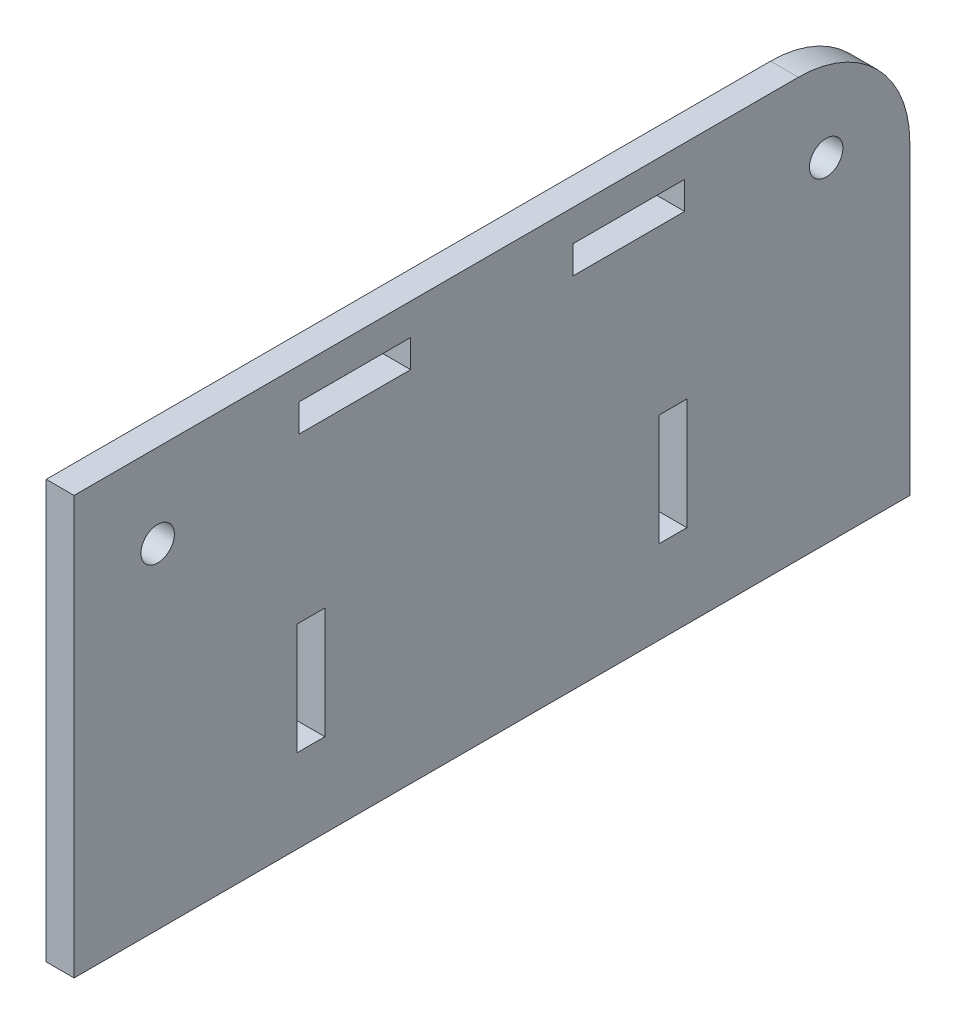
from build123d import *

# Parameters (mm, degrees)
SKETCH1_R           = 3.000854516
SKETCH1_W           = 5.001424193
SKETCH1_H           = 20.005696775
SKETCH1_W_2         = 20.005696776
SKETCH1_H_2         = 5.001424194
SKETCH1_W_3         = 20.005696775
SKETCH1_W_4         = 5.001424194
BOSS_EXTRUDE1_DEPTH = 5


with BuildPart() as part:
    # Sketch1 → Boss-Extrude1 (new body)
    with BuildSketch(Plane(origin=(0, 0, 0), x_dir=(0, 0, -1), z_dir=(1, 0, 0))):
        with BuildLine():
            Line((-105.391894776, -37.510681454), (44.616650387, -37.510681454))
            Line((44.616650387, -37.510681454), (44.616650387, 17.510681454))
            ThreePointArc((44.616650387, 17.510681454), (38.758786011, 31.652817078), (24.616650387, 37.510681454))
            Line((24.616650387, 37.510681454), (-105.391894776, 37.510681454))
            Line((-105.391894776, 37.510681454), (-105.391894776, -37.510681454))
        make_face()
        with Locations((29.612377806, 22.506408872)):
            Circle(SKETCH1_R, mode=Mode.SUBTRACT)
        with Locations(Location((-90.387622194, 22.506408872, 0), (0, 0, 180))):
            Circle(SKETCH1_R, mode=Mode.SUBTRACT)
        with Locations((2.10454474, -12.503560485)):
            Rectangle(SKETCH1_W, SKETCH1_H, mode=Mode.SUBTRACT)
        with Locations((-5.791359719, 29.352456285)):
            Rectangle(SKETCH1_W_2, SKETCH1_H_2, mode=Mode.SUBTRACT)
        with Locations((-54.98388467, 29.352456285)):
            Rectangle(SKETCH1_W_3, SKETCH1_H_2, mode=Mode.SUBTRACT)
        with Locations((-62.879789128, -12.503560485)):
            Rectangle(SKETCH1_W_4, SKETCH1_H, mode=Mode.SUBTRACT)
    extrude(amount=BOSS_EXTRUDE1_DEPTH)


solid = part.part
